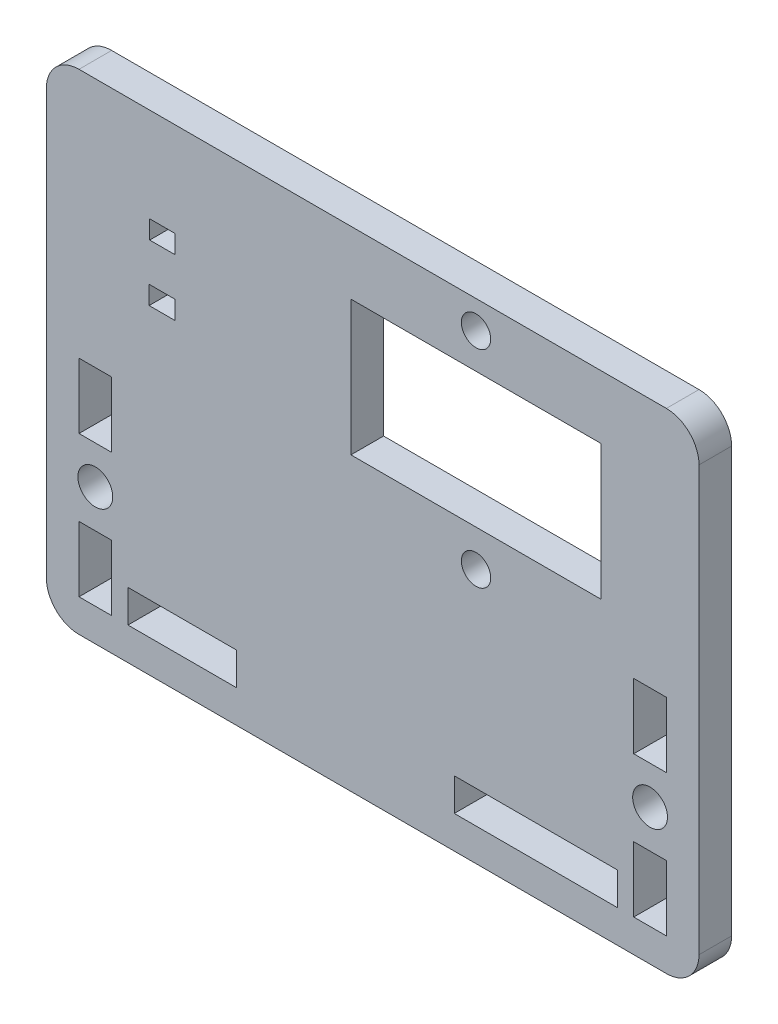
from build123d import *

# Parameters (mm, degrees)
SKETCH_1_R          = 1.35
SKETCH_1_W          = 10
SKETCH_1_H          = 3
SKETCH_1_W_2        = 3
SKETCH_1_H_2        = 6
SKETCH_1_W_3        = 2.381
SKETCH_1_H_3        = 1.694
SKETCH_1_W_4        = 2.327
SKETCH_1_H_4        = 1.693
SKETCH_1_W_5        = 22.999
SKETCH_1_H_5        = 12.401
SKETCH_1_W_6        = 15
EXTRUDE_1_DEPTH     = 3
SKETCH_2_R          = 1.6
CUT_EXTRUDE_1_DEPTH = 55.763647529


with BuildPart() as part:
    # 草图1 → 凸台-拉伸1 (new body)
    with BuildSketch(Plane(origin=(0, 0, 0), x_dir=(-1, 0, 0), z_dir=(0, 0, -1))):
        with BuildLine():
            Line((28.933183464, 3), (28.933183464, 41.999))
            ThreePointArc((28.933183464, 41.999), (28.054503808, 44.120320344), (25.933183464, 44.999))
            Line((25.933183464, 44.999), (-28.066816536, 44.999))
            ThreePointArc((-28.066816536, 44.999), (-30.18813688, 44.120320344), (-31.066816536, 41.999))
            Line((-31.066816536, 41.999), (-31.066816536, 3))
            ThreePointArc((-31.066816536, 3), (-30.18813688, 0.878679656), (-28.066816536, 0))
            Line((-28.066816536, 0), (25.933183464, 0))
            ThreePointArc((25.933183464, 0), (28.054503808, 0.878679656), (28.933183464, 3))
        make_face()
        with Locations(Location((-26.567767322, 12.499, 0), (0, 0, 180))):
            Circle(SKETCH_1_R, mode=Mode.SUBTRACT)
        with Locations(Location((-10.567816536, 23.43, 0), (0, 0, 180))):
            Circle(SKETCH_1_R, mode=Mode.SUBTRACT)
        with Locations(Location((24.432183464, 12.499, 0), (0, 0, 180))):
            Circle(SKETCH_1_R, mode=Mode.SUBTRACT)
        with Locations(Location((-10.567816536, 42.429, 0), (0, 0, 180))):
            Circle(SKETCH_1_R, mode=Mode.SUBTRACT)
        with Locations((16.432183464, 4.499)):
            Rectangle(SKETCH_1_W, SKETCH_1_H, mode=Mode.SUBTRACT)
        with Locations((24.433183464, 5.999)):
            Rectangle(SKETCH_1_W_2, SKETCH_1_H_2, mode=Mode.SUBTRACT)
        with Locations((24.433183464, 18.999)):
            Rectangle(SKETCH_1_W_2, SKETCH_1_H_2, mode=Mode.SUBTRACT)
        with Locations((18.298683464, 30.257)):
            Rectangle(SKETCH_1_W_3, SKETCH_1_H_3, mode=Mode.SUBTRACT)
        with Locations((18.271683464, 35.4965)):
            Rectangle(SKETCH_1_W_4, SKETCH_1_H_4, mode=Mode.SUBTRACT)
        with Locations((-10.567316536, 32.9995)):
            Rectangle(SKETCH_1_W_5, SKETCH_1_H_5, mode=Mode.SUBTRACT)
        with Locations((-16.067816536, 4.499)):
            Rectangle(SKETCH_1_W_6, SKETCH_1_H, mode=Mode.SUBTRACT)
        with Locations((-26.566816536, 5.999)):
            Rectangle(SKETCH_1_W_2, SKETCH_1_H_2, mode=Mode.SUBTRACT)
        with Locations((-26.566816536, 18.999)):
            Rectangle(SKETCH_1_W_2, SKETCH_1_H_2, mode=Mode.SUBTRACT)
    extrude(amount=-EXTRUDE_1_DEPTH)

    # 草图2 → 切除-拉伸1 (cut, through all)
    with BuildSketch(Plane.XY.offset(3)):
        with Locations((-24.432183464, 12.499)):
            Circle(SKETCH_2_R)
        with Locations((26.567767322, 12.499)):
            Circle(SKETCH_2_R)
    extrude(amount=-CUT_EXTRUDE_1_DEPTH, mode=Mode.SUBTRACT)


solid = part.part
